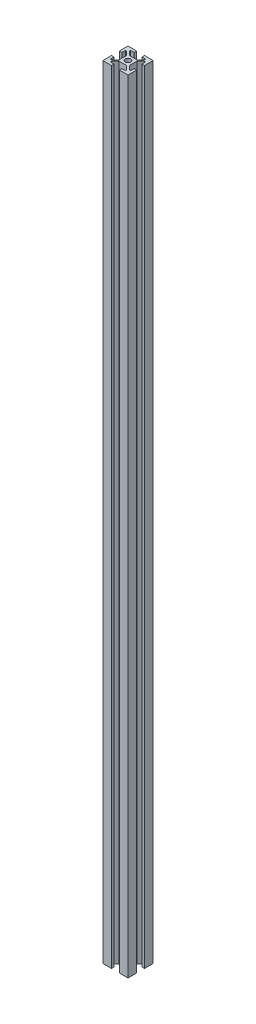
from build123d import *

# Parameters (mm, degrees)
SKETCH_1_R          = 2.15
EXTRUDE_1_DEPTH     = 622.3
SKETCH_3_R          = 3
CUT_EXTRUDE_1_DEPTH = 26


with BuildPart() as part:
    # 스케치1 → 보스-돌출1 (new body)
    with BuildSketch(Plane(origin=(0, 0, 0), x_dir=(1, 0, 0), z_dir=(0, 1, 0))):
        Polygon((3.1, 8), (6, 8), (6, 7), (3, 4), (0, 4), (-3, 4), (-6, 7), (-6, 8), (-3.1, 8), (-3.1, 9.998992087), (-10.001007855, 9.998992087), (-10.001007855, 3.1), (-8, 3.1), (-8, 6), (-7, 6), (-4, 3), (-4, 0), (-4, -3), (-7, -6), (-8, -6), (-8, -3.1), (-10.001007855, -3.1), (-10.001007855, -9.998992087), (-3.1, -9.998992087), (-3.1, -8), (-6, -8), (-6, -7), (-3, -4), (0, -4), (3, -4), (6, -7), (6, -8), (3.1, -8), (3.1, -9.998992087), (10.001007855, -9.998992087), (10.001007855, -3.1), (8, -3.1), (8, -6), (7, -6), (4, -3), (4, 0), (4, 3), (7, 6), (8, 6), (8, 3.1), (10.001007855, 3.1), (10.001007855, 9.998992087), (3.1, 9.998992087), align=None)
        with Locations(Location((0, 0, 0), (0, 0, 270))):
            Circle(SKETCH_1_R, mode=Mode.SUBTRACT)
    extrude(amount=EXTRUDE_1_DEPTH)

    # 스케치3 → 컷-돌출1 (cut)
    with BuildSketch(Plane(origin=(10.001007855, 0, 0), x_dir=(0, 0, -1), z_dir=(1, 0, 0))):
        with Locations((0, 311.15)):
            Circle(SKETCH_3_R)
    extrude(amount=-CUT_EXTRUDE_1_DEPTH, mode=Mode.SUBTRACT)


solid = part.part
